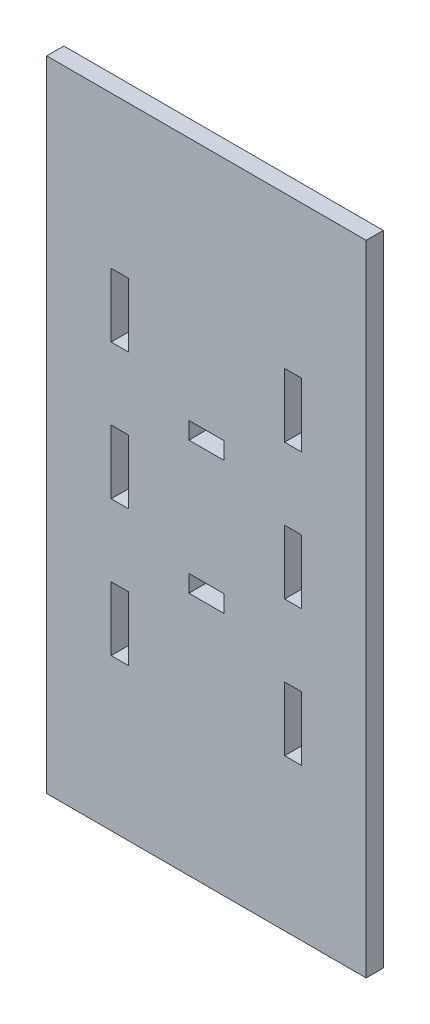
from build123d import *

# Parameters (mm, degrees)
MODEL_W             = 100
MODEL_H             = 200
MODEL_W_2           = 5.35
MODEL_H_2           = 20
MODEL_W_3           = 11
MODEL_H_3           = 5.35
BOSS_EXTRUDE1_DEPTH = 5.35


with BuildPart() as part:
    # Model → Boss-Extrude1 (new body)
    with BuildSketch(Plane.XY):
        with Locations((50, 100)):
            Rectangle(MODEL_W, MODEL_H)
        with Locations((22.845, 142.5)):
            Rectangle(MODEL_W_2, MODEL_H_2, mode=Mode.SUBTRACT)
        with Locations((77.155, 57.5)):
            Rectangle(MODEL_W_2, MODEL_H_2, mode=Mode.SUBTRACT)
        with Locations((22.845, 100)):
            Rectangle(MODEL_W_2, MODEL_H_2, mode=Mode.SUBTRACT)
        with Locations((22.845, 57.5)):
            Rectangle(MODEL_W_2, MODEL_H_2, mode=Mode.SUBTRACT)
        with Locations((77.155, 100)):
            Rectangle(MODEL_W_2, MODEL_H_2, mode=Mode.SUBTRACT)
        with Locations((77.155, 142.5)):
            Rectangle(MODEL_W_2, MODEL_H_2, mode=Mode.SUBTRACT)
        with Locations((50, 120.75)):
            Rectangle(MODEL_W_3, MODEL_H_3, mode=Mode.SUBTRACT)
        with Locations((50, 79.25)):
            Rectangle(MODEL_W_3, MODEL_H_3, mode=Mode.SUBTRACT)
    extrude(amount=BOSS_EXTRUDE1_DEPTH)


solid = part.part
